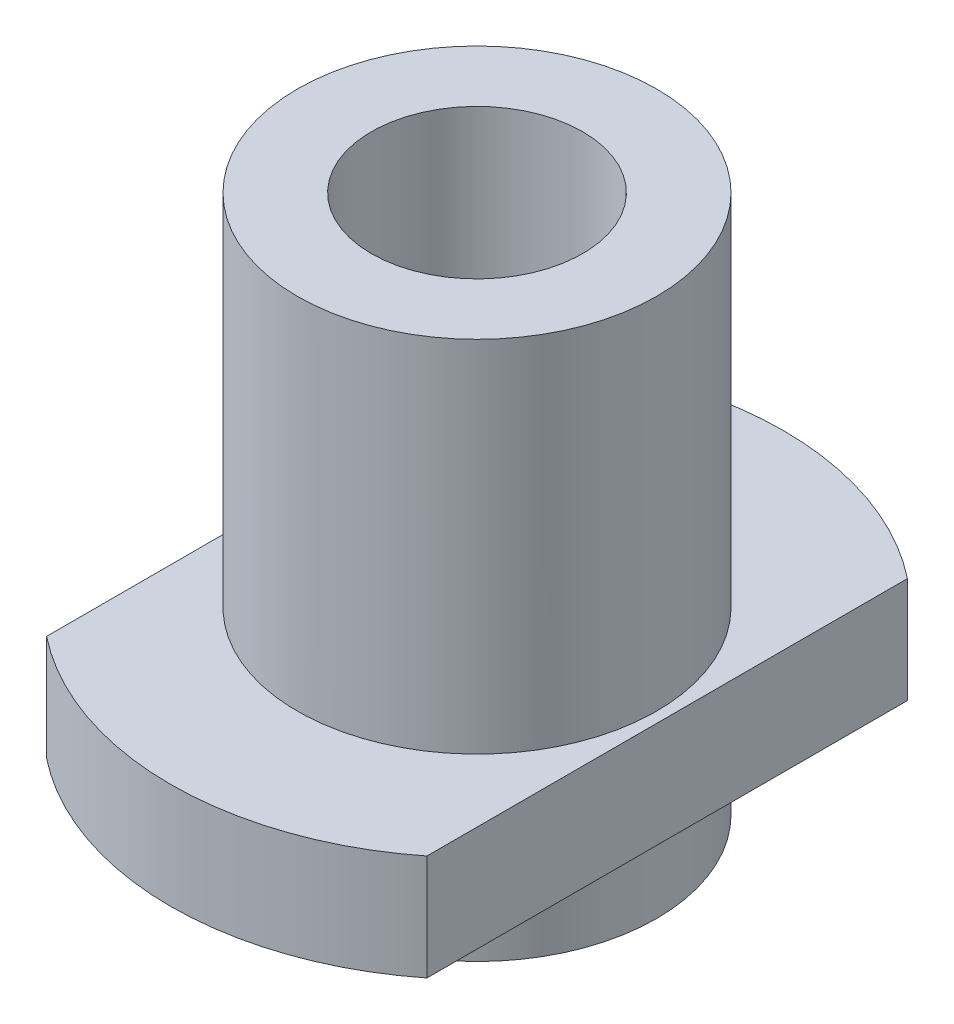
from build123d import *

# Parameters (mm, degrees)
SKETCH_1_R      = 17
SKETCH_1_R_2    = 10
EXTRUDE_1_DEPTH = 51
EXTRUDE_START   = -7
SKETCH_7_R      = 10
EXTRUDE_2_DEPTH = 10


with BuildPart() as part:
    # 草图1 → 凸台-拉伸1 (new body)
    with BuildSketch(Plane(origin=(0, 0, 0), x_dir=(1, 0, 0), z_dir=(0, 1, 0))):
        with Locations(Location((0, 0, 0), (0, 0, 270))):
            Circle(SKETCH_1_R)
        with Locations(Location((0, 0, 0), (0, 0, 270))):
            Circle(SKETCH_1_R_2, mode=Mode.SUBTRACT)
    extrude(amount=EXTRUDE_1_DEPTH)

    # 草图7 → 凸台-拉伸2 (add)
    with BuildSketch(Plane.XZ.offset(EXTRUDE_START)):
        with BuildLine():
            Line((-18, 22.737634002), (-18, -22.737634002))
            ThreePointArc((-18, -22.737634002), (0, -29), (18, -22.737634002))
            Line((18, -22.737634002), (18, 22.737634002))
            ThreePointArc((18, 22.737634002), (0, 29), (-18, 22.737634002))
        make_face()
        with Locations(Location((0, 0, 0), (0, 0, 90))):
            Circle(SKETCH_7_R, mode=Mode.SUBTRACT)
    extrude(amount=-EXTRUDE_2_DEPTH)


solid = part.part
